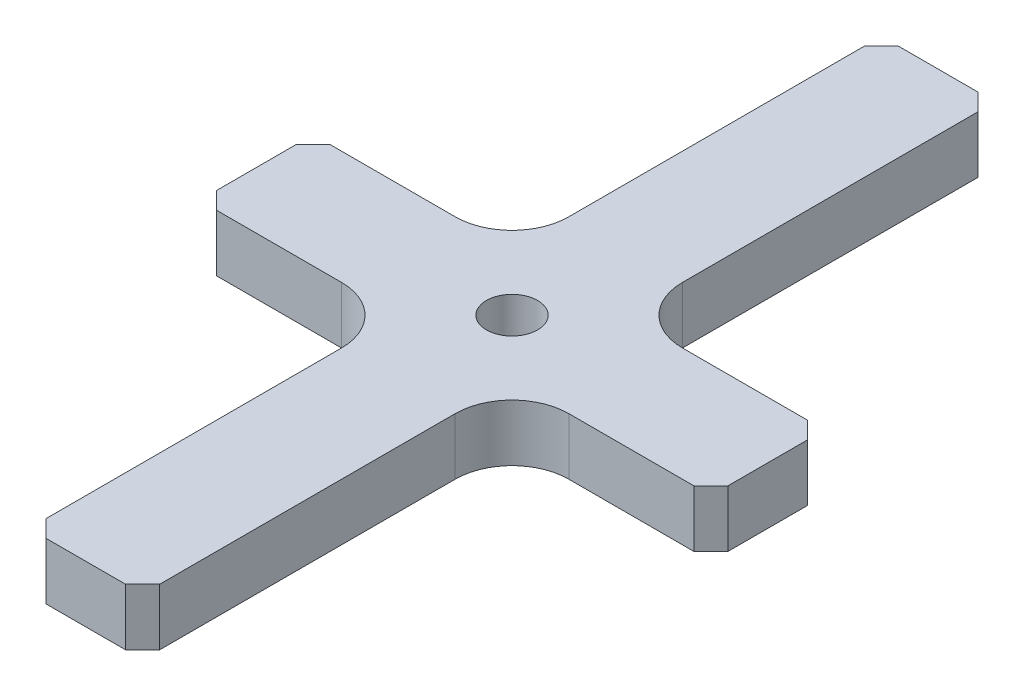
from build123d import *

# Parameters (mm, degrees)
BOSS_EXTRUDE1_DEPTH      = 2.5
FILLET1_R                = 5
CHAMFER1_SIZE            = 1.5
M4_CLEARANCE_HOLE1_D     = 4.5
M4_CLEARANCE_HOLE1_DEPTH = 5.2
M4_CLEARANCE_HOLE1_TIP   = 1.351936393


with BuildPart() as part:
    # Sketch2 → Boss-Extrude1 (new, symmetric)
    with BuildSketch(Plane(origin=(0, 0, 0), x_dir=(1, 0, 0), z_dir=(0, 1, 0))):
        Polygon((-5, 37.5), (5, 37.5), (5, 5), (22.5, 5), (22.5, -5), (5, -5), (5, -37.5), (-5, -37.5), (-5, -5), (-22.5, -5), (-22.5, 5), (-5, 5), align=None)
    extrude(amount=BOSS_EXTRUDE1_DEPTH, both=True)

    # Fillet1
    fillet1_edges = [part.edges().sort_by_distance(p)[0] for p in [
        (5, 0, 5),
        (-5, 0, 5),
        (-5, 0, -5),
        (5, 0, -5),
    ]]
    fillet(fillet1_edges, radius=FILLET1_R)

    # Chamfer1
    chamfer1_edges = [part.edges().sort_by_distance(p)[0] for p in [
        (22.5, 0, -5),
        (22.5, 0, 5),
        (5, 0, 37.5),
        (-5, 0, 37.5),
        (-22.5, 0, 5),
        (-22.5, 0, -5),
        (-5, 0, -37.5),
        (5, 0, -37.5),
    ]]
    chamfer(chamfer1_edges, length=CHAMFER1_SIZE)

    # M4 Clearance Hole1
    with Locations(Plane(origin=(0, 2.5, 0), x_dir=(1, 0, 0), z_dir=(0, 1, 0))):
        with Locations((0, 0)):
            Hole(M4_CLEARANCE_HOLE1_D / 2, depth=M4_CLEARANCE_HOLE1_DEPTH)
            with Locations((0, 0, -(M4_CLEARANCE_HOLE1_DEPTH + M4_CLEARANCE_HOLE1_TIP / 2))):  # 118° drill point
                Cone(0, M4_CLEARANCE_HOLE1_D / 2, M4_CLEARANCE_HOLE1_TIP, mode=Mode.SUBTRACT)


solid = part.part
